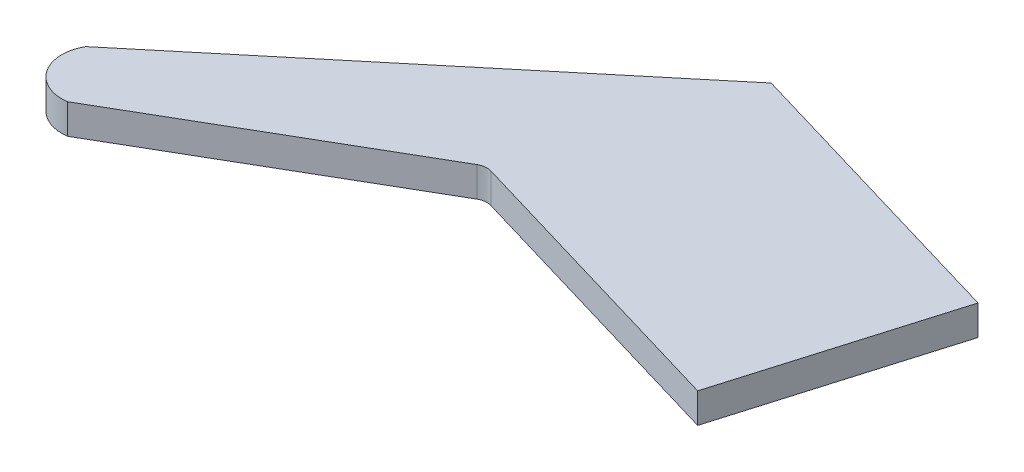
from build123d import *

# Parameters (mm, degrees)
BOSS_EXTRUDE1_DEPTH = 4.7625


with BuildPart() as part:
    # Sketch1 → Boss-Extrude1 (new body)
    with BuildSketch(Plane(origin=(0, 0, 0), x_dir=(1, 0, 0), z_dir=(0, 1, 0))):
        with BuildLine():
            Line((22.994624733, -31.524992416), (-18.204730368, -55.415445829))
            ThreePointArc((-18.204730368, -55.415445829), (-24.10202239, -52.817624121), (-24.351569793, -46.378334027))
            Line((-24.351569793, -46.378334027), (35.179941753, 3.113165809))
            Line((35.179941753, 3.113165809), (81.92289285, -10.7327271))
            Line((81.92289285, -10.7327271), (71.73313232, -45.132782137))
            Line((71.73313232, -45.132782137), (24.990181224, -31.286889228))
            ThreePointArc((24.990181224, -31.286889228), (23.967852385, -31.200180886), (22.994624733, -31.524992416))
        make_face()
    extrude(amount=BOSS_EXTRUDE1_DEPTH)


solid = part.part
